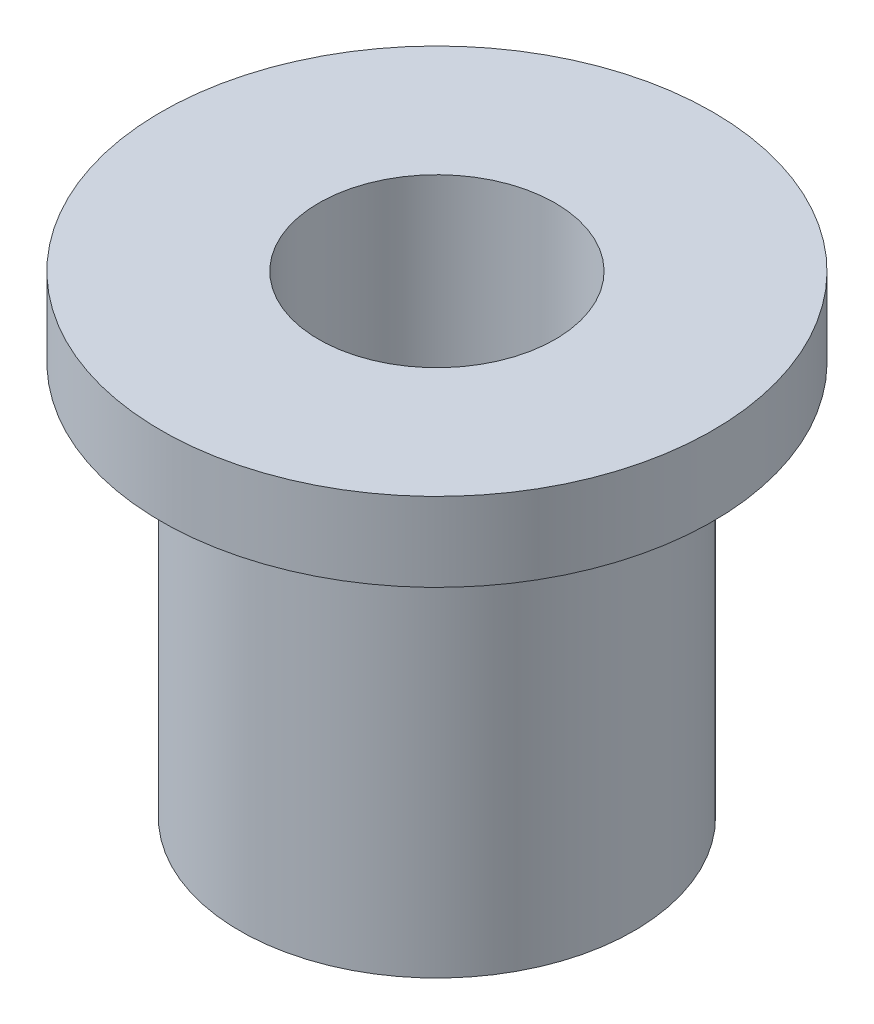
from build123d import *


with BuildPart() as part:
    # Sketch1 → Revolve1 (revolve)
    with BuildSketch(Plane.XY, mode=Mode.PRIVATE) as revolve1_sk:
        Polygon((4.5, 0), (7.5, 0), (7.5, 15), (10.5, 15), (10.5, 18), (4.5, 18), align=None)
    revolve(revolve1_sk.sketch.rotate(Axis((0, 0, 0), (0, 1, 0)), 90), axis=Axis((0, 0, 0), (0, 1, 0)))


solid = part.part
